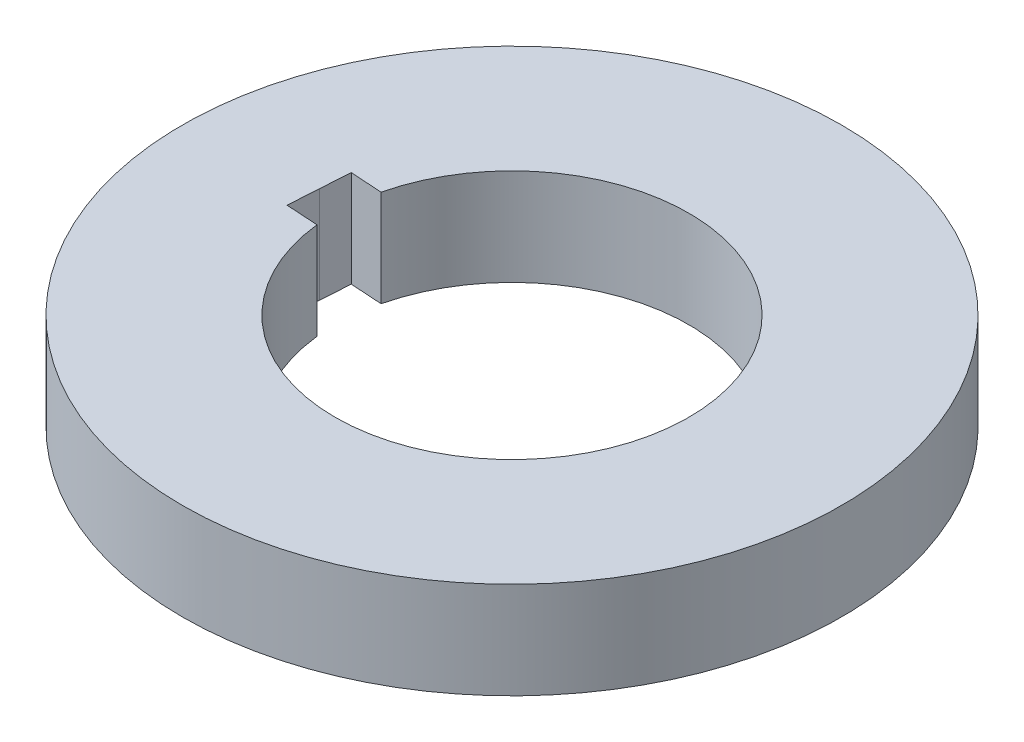
from build123d import *

# Parameters (mm, degrees)
SKETCH_1_R          = 17.05
EXTRUDE_1_DEPTH     = 5
SKETCH_2_R          = 9.15
CUT_EXTRUDE_1_DEPTH = 5
CUT_EXTRUDE_2_DEPTH = 25.625291876


with BuildPart() as part:
    # 草圖1 → 填料-伸長1 (new body)
    with BuildSketch(Plane(origin=(0, 0, 0), x_dir=(1, 0, 0), z_dir=(0, 1, 0))):
        with Locations(Location((0, 0, 0), (0, 0, 270))):
            Circle(SKETCH_1_R)
    extrude(amount=EXTRUDE_1_DEPTH)

    # 草圖2 → 除料-伸長1 (cut)
    with BuildSketch(Plane(origin=(0, 5, 0), x_dir=(1, 0, 0), z_dir=(0, 1, 0))):
        with Locations(Location((0, 0, 0), (0, 0, 270))):
            Circle(SKETCH_2_R)
    extrude(amount=-CUT_EXTRUDE_1_DEPTH, mode=Mode.SUBTRACT)

    # 草圖3 → 除料-伸長2 (cut, through all)
    with BuildSketch(Plane(origin=(0, 5, 0), x_dir=(1, 0, 0), z_dir=(0, 1, 0))):
        Polygon((-10.647976509, 0.685197974), (-10.548439784, 2.231998685), (-8.899610355, 2.125896405), (-9.095873569, -0.993772622), (-10.74706795, -0.889893424), align=None)
    extrude(amount=-CUT_EXTRUDE_2_DEPTH, mode=Mode.SUBTRACT)


solid = part.part
